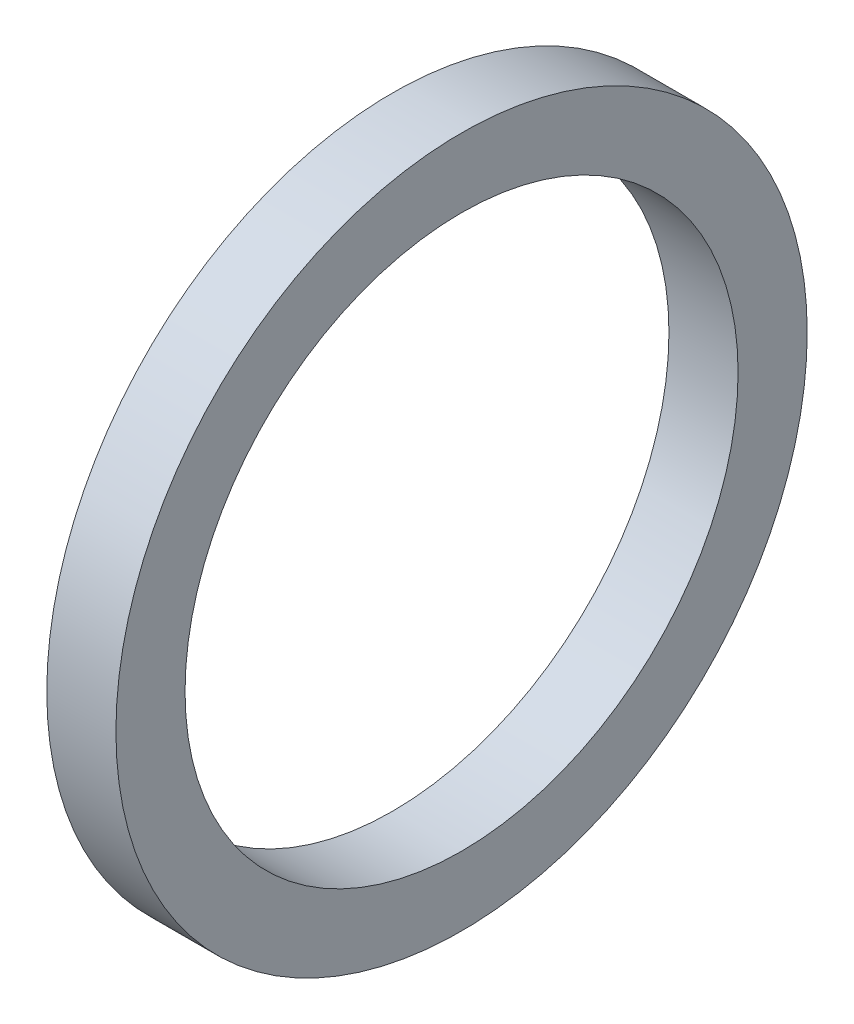
from build123d import *

# Parameters (mm, degrees)
SKETCH1_W = 5
SKETCH1_H = 5


with BuildPart() as part:
    # Sketch1 → Revolve1 (revolve)
    with BuildSketch(Plane(origin=(0, 0, 0), x_dir=(1, 0, 0), z_dir=(0, 1, 0)), mode=Mode.PRIVATE) as revolve1_sk:
        with Locations((2.5, 22.5)):
            Rectangle(SKETCH1_W, SKETCH1_H)
    revolve(revolve1_sk.sketch.rotate(Axis((0, 0, 0), (1, 0, 0)), 180), axis=Axis((0, 0, 0), (1, 0, 0)))


solid = part.part
